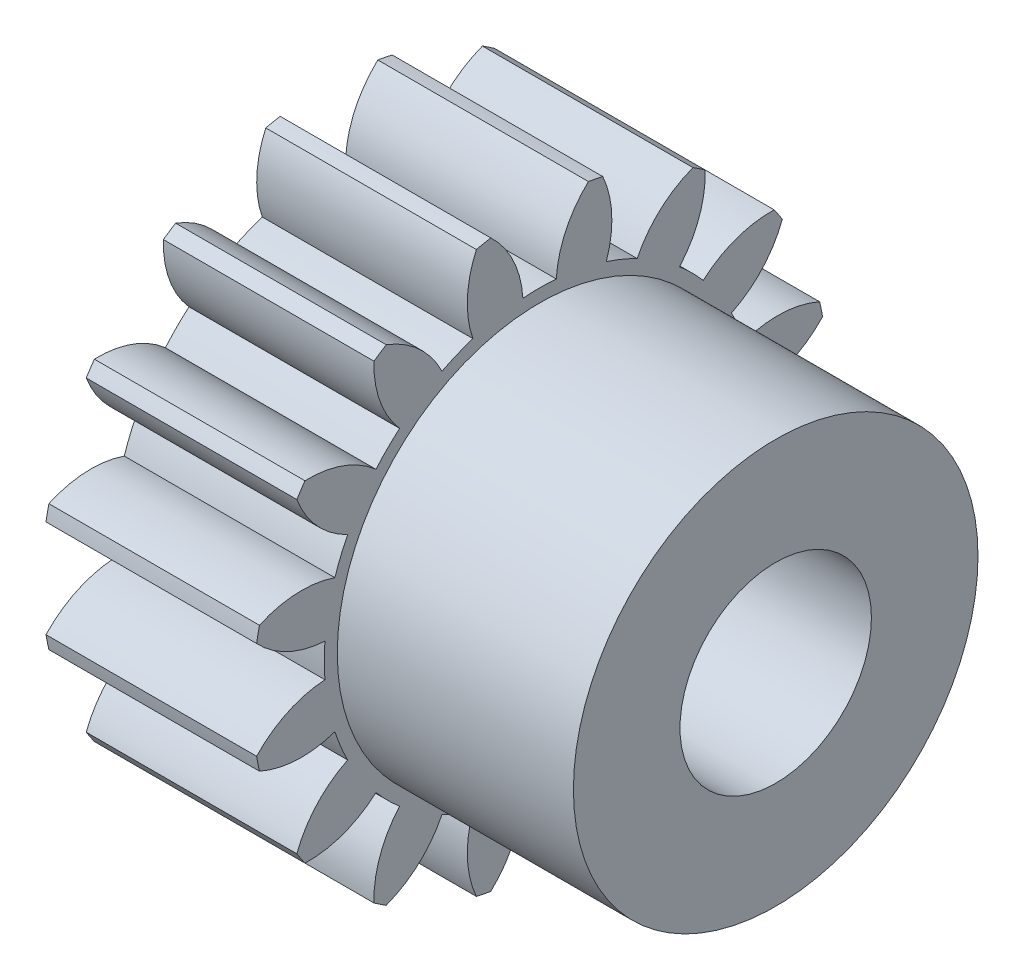
from build123d import *

# Parameters (mm, degrees)
BASPROSKE_W        = 3.3
BASPROSKE_H        = 4.5
TOOTHCUT_DEPTH     = 8.168681887
TEETHCUTS_COUNT    = 16
TEETHCUTS_ANGLE    = 337.5
BORSKE_R           = 1.5
BORE_DEPTH         = 50.0000508
BOSS_EXTRU_1_START = 3.7
ESQUISSE1_R        = 3.17
ESQUISSE1_R_2      = 1.5
BOSS_EXTRU_1_DEPTH = 3.7


with BuildPart() as part:
    # BasProSke → Base-Revolve (revolve)
    with BuildSketch(Plane(origin=(0, 0, 0), x_dir=(1, 0, 0), z_dir=(0, 1, 0)), mode=Mode.PRIVATE) as base_revolve_sk:
        with Locations((1.65, 2.25)):
            Rectangle(BASPROSKE_W, BASPROSKE_H)
    revolve(base_revolve_sk.sketch.rotate(Axis((-10, 0, 0), (1, 0, 0)), 180), axis=Axis((-10, 0, 0), (1, 0, 0)))

    # TooCutSke → ToothCut (cut, through all)
    with BuildSketch(Plane(origin=(0, 0, 0), x_dir=(0, 0, -1), z_dir=(1, 0, 0))):
        with BuildLine():
            ThreePointArc((0.261866103, 3.363822549), (0, 3.374), (-0.261866103, 3.363822549))
            ThreePointArc((-0.261866103, 3.363822549), (-0.417714668, 3.961827375), (-0.788562282, 4.456165918))
            ThreePointArc((-0.788562282, 4.456165918), (0, 4.5254), (0.788562282, 4.456165918))
            ThreePointArc((0.788562282, 4.456165918), (0.417714668, 3.961827375), (0.261866103, 3.363822549))
        make_face()
    toothcut = extrude(amount=TOOTHCUT_DEPTH, mode=Mode.SUBTRACT)

    # TeethCuts: ToothCut ×16 about axis
    teethcuts_axis = Axis((-10, 0, 0), (1, 0, 0))
    for i in range(1, TEETHCUTS_COUNT):
        add(toothcut.rotate(teethcuts_axis, i * TEETHCUTS_ANGLE / (TEETHCUTS_COUNT - 1)), mode=Mode.SUBTRACT)

    # BorSke → Bore (cut, symmetric)
    with BuildSketch(Plane(origin=(0, 0, 0), x_dir=(0, 0, -1), z_dir=(1, 0, 0))):
        with Locations(Location((0, 0, 0), (0, 0, 180))):
            Circle(BORSKE_R)
    extrude(amount=BORE_DEPTH, both=True, mode=Mode.SUBTRACT)

    # Esquisse1 → Boss.-Extru.1 (add)
    with BuildSketch(Plane(origin=(3.3, 0, 0), x_dir=(0, 0, -1), z_dir=(1, 0, 0)).offset(BOSS_EXTRU_1_START)):
        with Locations(Location((0, 0, 0), (0, 0, 180))):
            Circle(ESQUISSE1_R)
        Circle(ESQUISSE1_R_2, mode=Mode.SUBTRACT)
    extrude(amount=-BOSS_EXTRU_1_DEPTH)


solid = part.part
